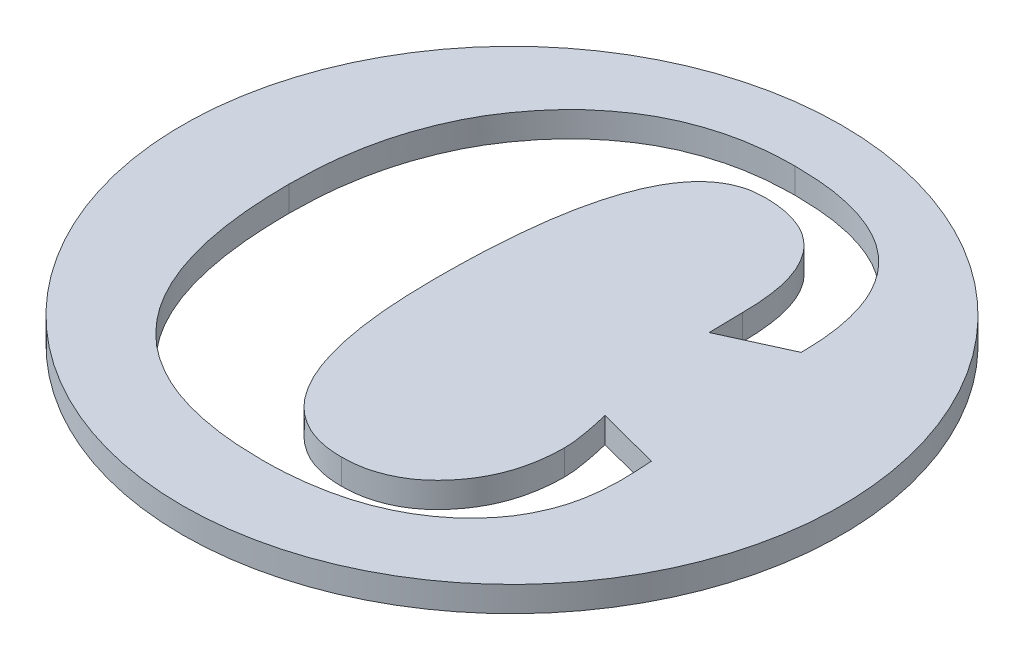
from build123d import *

# Parameters (mm, degrees)
SKETCH1_R           = 13
BOSS_EXTRUDE1_DEPTH = 1
CUT_EXTRUDE1_DEPTH  = 1


with BuildPart() as part:
    # Sketch1 → Boss-Extrude1 (new body)
    with BuildSketch(Plane(origin=(0, 0, 0), x_dir=(1, 0, 0), z_dir=(0, 1, 0))):
        with Locations(Location((0, 0, 0), (0, 0, 270))):
            Circle(SKETCH1_R)
    extrude(amount=BOSS_EXTRUDE1_DEPTH)

    # Sketch2 → Cut-Extrude1 (cut)
    with BuildSketch(Plane(origin=(0, 1, 0), x_dir=(1, 0, 0), z_dir=(0, 1, 0))):
        with BuildLine():
            Line((5.25239325, -1.5848325), (7.730691862, -2.231533889))
            add(Edge.make_bspline(
                [(7.730691862, -2.231533889), (7.745854907, -2.465826289), (7.774011213, -2.900884585), (7.780007907, -3.336797312), (7.782775195, -3.5379575)],
                knots=[0, 0, 0, 0, 1.077062099, 2, 2, 2, 2], degree=3))
            add(Edge.make_bspline(
                [(7.782775195, -3.5379575), (7.775734441, -3.772666286), (7.76198387, -4.231051786), (7.665106789, -4.902107863), (7.503534805, -5.53719048), (7.262506376, -6.13254792), (6.970171749, -6.697349561), (6.599918526, -7.220612544), (6.167294917, -7.709069047), (5.673484979, -8.159929958), (5.121589843, -8.561266158), (4.525330961, -8.915315997), (3.88158819, -9.210662332), (3.194771896, -9.454210567), (2.461957382, -9.639228793), (1.685716726, -9.772679799), (0.864809488, -9.857517539), (0.301796476, -9.866054195), (0.013677973, -9.870422778)],
                knots=[0, 0, 0, 0, 0.99838358, 1.9498399, 2.87846334, 3.779167422, 4.676774372, 5.578403417, 6.498521769, 7.448363946, 8.417281084, 9.396931457, 10.393890904, 11.425717394, 12.493153504, 13.605299621, 14.774526564, 16, 16, 16, 16], degree=3))
            add(Edge.make_bspline(
                [(0.013677973, -9.870422778), (-0.345453387, -9.863405493), (-1.042591343, -9.849783693), (-2.054913482, -9.730806098), (-2.997808304, -9.537362324), (-3.874251245, -9.270503592), (-4.678201905, -8.917315993), (-5.411628354, -8.48501399), (-6.080262751, -7.979187866), (-6.671165693, -7.386273411), (-7.201957369, -6.724194549), (-7.653742039, -5.97838427), (-8.036288232, -5.157199578), (-8.347723272, -4.258020447), (-8.589436148, -3.28160554), (-8.760231838, -2.227786178), (-8.865609009, -1.096529571), (-8.877670491, -0.316264728), (-8.883891472, 0.086174444)],
                knots=[0, 0, 0, 0, 1.125976169, 2.185720361, 3.191248848, 4.14129961, 5.053465363, 5.93822711, 6.80577772, 7.675236456, 8.556734678, 9.460955445, 10.40277975, 11.392896532, 12.440517575, 13.553427658, 14.738125192, 16, 16, 16, 16], degree=3))
            add(Edge.make_bspline(
                [(-8.883891472, 0.086174444), (-8.877144448, 0.471355807), (-8.86396985, 1.223481467), (-8.739062258, 2.323761593), (-8.537683843, 3.368297285), (-8.25053484, 4.357501558), (-7.88374945, 5.291207721), (-7.443760547, 6.173716613), (-6.907249974, 6.992501414), (-6.303194776, 7.754037533), (-5.634782916, 8.444869562), (-4.903943631, 9.039841274), (-4.13324793, 9.555570007), (-3.305494781, 9.969042017), (-2.430073405, 10.289949015), (-1.506733392, 10.522051081), (-0.534275431, 10.656589456), (0.130450492, 10.675493327), (0.469407139, 10.685132778)],
                knots=[0, 0, 0, 0, 1.163899941, 2.272693063, 3.342163629, 4.375955692, 5.38130337, 6.37089149, 7.350964679, 8.334427181, 9.30546345, 10.250064938, 11.177916844, 12.10296145, 13.039623816, 13.99100338, 14.975573636, 16, 16, 16, 16], degree=3))
            add(Edge.make_bspline(
                [(0.469407139, 10.685132778), (0.731368093, 10.679403838), (1.24032138, 10.668273314), (1.980031414, 10.603376578), (2.666696134, 10.474000255), (3.305409253, 10.309794879), (3.889173706, 10.08444307), (4.428427211, 9.822804709), (4.914586315, 9.502127233), (5.349181396, 9.133633154), (5.732807037, 8.715102812), (6.062391941, 8.247124839), (6.347469876, 7.733536448), (6.571984508, 7.166341162), (6.748453612, 6.552678606), (6.879804132, 5.890982879), (6.951396325, 5.180354064), (6.961564938, 4.691361745), (6.966802973, 4.439473056)],
                knots=[0, 0, 0, 0, 1.216450272, 2.363391781, 3.442411128, 4.457483076, 5.420551553, 6.342768242, 7.235147886, 8.116718114, 8.981990498, 9.863560726, 10.768467107, 11.70271401, 12.689043052, 13.729727606, 14.830542089, 16, 16, 16, 16], degree=3))
            Line((6.966802973, 4.439473056), (4.475483528, 3.302320278))
            add(Edge.make_bspline(
                [(4.475483528, 3.302320278), (4.470106952, 3.438293944), (4.45992788, 3.695722764), (4.461276647, 4.056170034), (4.447142903, 4.368506474), (4.448715354, 4.55954313), (4.449441862, 4.647806389)],
                knots=[0, 0, 0, 0, 1.21319996, 2.296861169, 3.213111309, 4, 4, 4, 4], degree=3))
            add(Edge.make_bspline(
                [(4.449441862, 4.647806389), (4.447722623, 4.824448026), (4.444391201, 5.166731988), (4.396660933, 5.661731695), (4.337462463, 6.125936258), (4.234766253, 6.552649254), (4.115177918, 6.949061221), (3.964373313, 7.308698933), (3.783801492, 7.63357582), (3.580758496, 7.927608424), (3.344642243, 8.184947546), (3.080877209, 8.407247168), (2.794090455, 8.602656301), (2.472644536, 8.751215907), (2.129602996, 8.876345015), (1.755447324, 8.955010862), (1.356440833, 9.009630083), (1.080143634, 9.015466719), (0.938157139, 9.018466111)],
                knots=[0, 0, 0, 0, 1.322247294, 2.562159472, 3.722092324, 4.823306397, 5.844541812, 6.820517713, 7.73713301, 8.62386865, 9.490450857, 10.343654022, 11.203094787, 12.080246692, 12.988369862, 13.932056947, 14.937303798, 16, 16, 16, 16], degree=3))
            add(Edge.make_bspline(
                [(0.938157139, 9.018466111), (0.786942196, 9.012673682), (0.491913679, 9.001372339), (0.064405318, 8.885963451), (-0.332873883, 8.703985183), (-0.69991465, 8.444701136), (-1.036329743, 8.114914494), (-1.33955244, 7.710706144), (-1.612917553, 7.235906282), (-1.860109833, 6.690970947), (-2.074074797, 6.070923113), (-2.264395958, 5.381001791), (-2.423002996, 4.619720467), (-2.553018757, 3.7867718), (-2.649338988, 2.881263355), (-2.723635136, 1.902892729), (-2.766722621, 0.853348432), (-2.770719009, 0.129616858), (-2.772780361, -0.243686667)],
                knots=[0, 0, 0, 0, 0.663754609, 1.295021072, 1.932796925, 2.5771421, 3.261147111, 3.996780335, 4.792416042, 5.666644777, 6.624635675, 7.674451774, 8.812674813, 10.04299616, 11.380987675, 12.816846398, 14.358117152, 16, 16, 16, 16], degree=3))
            add(Edge.make_bspline(
                [(-2.772780361, -0.243686667), (-2.769234908, -0.564921798), (-2.762363487, -1.187505667), (-2.715752199, -2.089773852), (-2.634330422, -2.929957842), (-2.518780135, -3.708339901), (-2.367195765, -4.425682347), (-2.18616641, -5.08138104), (-1.977536957, -5.676945191), (-1.721955983, -6.20495828), (-1.442920917, -6.676002474), (-1.128010362, -7.08687999), (-0.775787049, -7.432245929), (-0.387635905, -7.711578053), (0.02746432, -7.94149635), (0.483873953, -8.086328054), (0.968240334, -8.189856946), (1.303586281, -8.199030191), (1.476351584, -8.203756111)],
                knots=[0, 0, 0, 0, 1.528653098, 2.962673341, 4.297845131, 5.544148307, 6.705400685, 7.784456391, 8.779695543, 9.703504234, 10.571332445, 11.381068858, 12.160045423, 12.90918257, 13.651518771, 14.406987965, 15.179303616, 16, 16, 16, 16], degree=3))
            add(Edge.make_bspline(
                [(1.476351584, -8.203756111), (1.61974551, -8.199179957), (1.902048757, -8.190170766), (2.316640973, -8.13115633), (2.709880212, -8.019466978), (3.085346323, -7.871676439), (3.444251194, -7.683979914), (3.784176044, -7.453188362), (4.102744826, -7.17621313), (4.399160241, -6.860901751), (4.671310822, -6.515633609), (4.911973057, -6.146309401), (5.111323132, -5.752451865), (5.277229417, -5.340485015), (5.402928553, -4.906821297), (5.493239479, -4.453833285), (5.552273744, -3.979325579), (5.557758131, -3.655325036), (5.560552973, -3.490214444)],
                knots=[0, 0, 0, 0, 0.988561849, 1.946206698, 2.877739568, 3.799990945, 4.723373952, 5.6638324, 6.625467346, 7.627221263, 8.642730559, 9.652395785, 10.660385053, 11.680779451, 12.709570302, 13.767670509, 14.862405475, 16, 16, 16, 16], degree=3))
            add(Edge.make_bspline(
                [(5.560552973, -3.490214444), (5.557098155, -3.369930029), (5.549404006, -3.102047251), (5.479283066, -2.663994986), (5.38676253, -2.147904033), (5.299251417, -1.781190622), (5.25239325, -1.5848325)],
                knots=[0, 0, 0, 0, 0.745982987, 1.661362321, 2.747767356, 4, 4, 4, 4], degree=3))
        make_face()
    extrude(amount=-CUT_EXTRUDE1_DEPTH, mode=Mode.SUBTRACT)


solid = part.part
